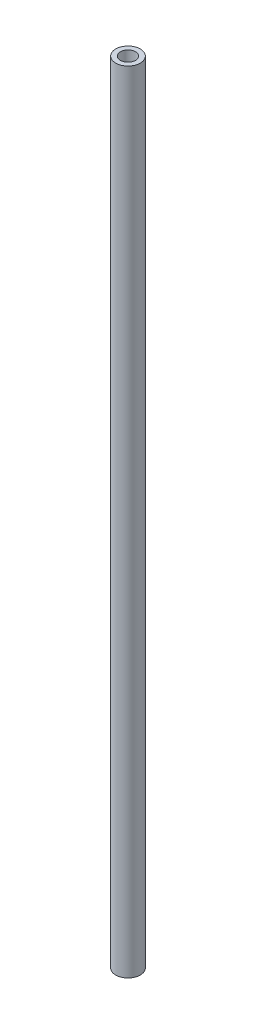
from build123d import *

# Parameters (mm, degrees)
SKETCH1_R           = 4.953
SKETCH1_R_2         = 3.048
BOSS_EXTRUDE1_DEPTH = 318.399999978


with BuildPart() as part:
    # Sketch1 → Boss-Extrude1 (new body)
    with BuildSketch(Plane(origin=(0, 0, 0), x_dir=(1, 0, 0), z_dir=(0, 1, 0))):
        with Locations(Location((0, 0, 0), (0, 0, 270))):
            Circle(SKETCH1_R)
        with Locations(Location((0, 0, 0), (0, 0, 270))):
            Circle(SKETCH1_R_2, mode=Mode.SUBTRACT)
    extrude(amount=BOSS_EXTRUDE1_DEPTH)


solid = part.part
